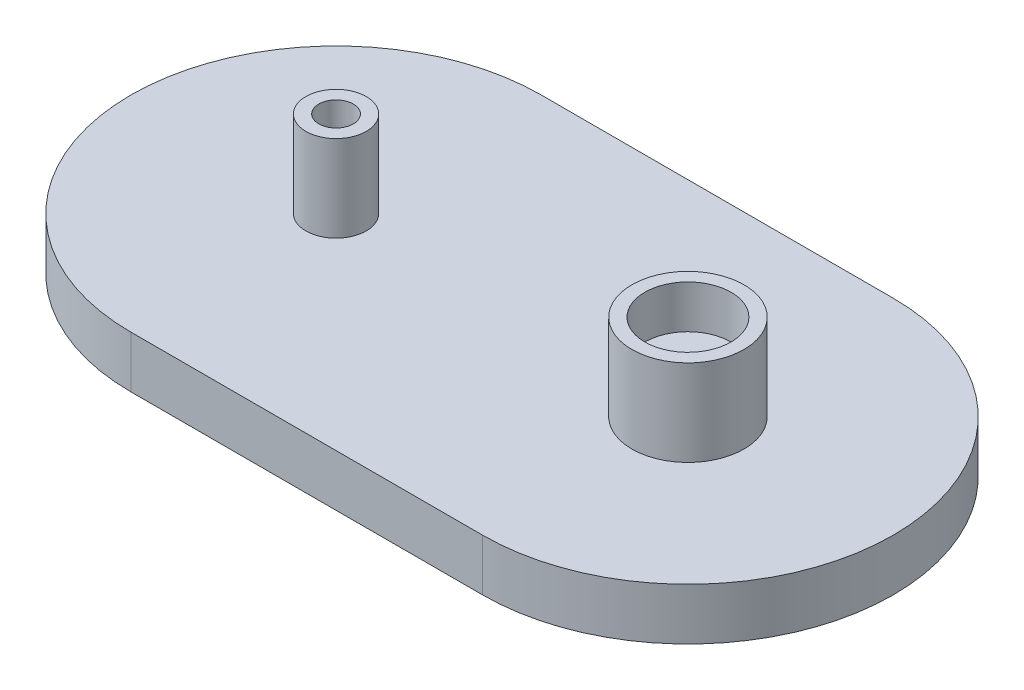
from build123d import *

# Parameters (mm, degrees)
BOSS_EXTRU_1_DEPTH      = 3
ESQUISSE2_R             = 1.75
ESQUISSE2_R_2           = 3.25
BOSS_EXTRU_2_DEPTH      = 5
ESQUISSE3_R             = 1
ESQUISSE3_R_2           = 2.5
ENL_V_MAT_EXTRU_1_DEPTH = 2.5


with BuildPart() as part:
    # Esquisse1 → Boss.-Extru.1 (new body)
    with BuildSketch(Plane(origin=(0, 0, 0), x_dir=(1, 0, 0), z_dir=(0, 1, 0))):
        with BuildLine():
            Line((10.2, -11.9), (-10.2, -11.9))
            ThreePointArc((-10.2, -11.9), (-22.1, 0), (-10.2, 11.9))
            Line((-10.2, 11.9), (10.2, 11.9))
            ThreePointArc((10.2, 11.9), (22.1, 0), (10.2, -11.9))
        make_face()
    extrude(amount=BOSS_EXTRU_1_DEPTH)

    # Esquisse2 → Boss.-Extru.2 (add)
    with BuildSketch(Plane(origin=(0, 3, 0), x_dir=(1, 0, 0), z_dir=(0, 1, 0))):
        with Locations(Location((-10.2, 0, 0), (0, 0, 270))):
            Circle(ESQUISSE2_R)
        with Locations(Location((10.2, 0, 0), (0, 0, 270))):
            Circle(ESQUISSE2_R_2)
    extrude(amount=BOSS_EXTRU_2_DEPTH)

    # Esquisse3 → Enlèv. mat.-Extru.1 (cut)
    with BuildSketch(Plane(origin=(0, 8, 0), x_dir=(1, 0, 0), z_dir=(0, 1, 0))):
        with Locations(Location((-10.2, 0, 0), (0, 0, 270))):
            Circle(ESQUISSE3_R)
        with Locations(Location((10.2, 0, 0), (0, 0, 270))):
            Circle(ESQUISSE3_R_2)
    extrude(amount=-ENL_V_MAT_EXTRU_1_DEPTH, mode=Mode.SUBTRACT)


solid = part.part
